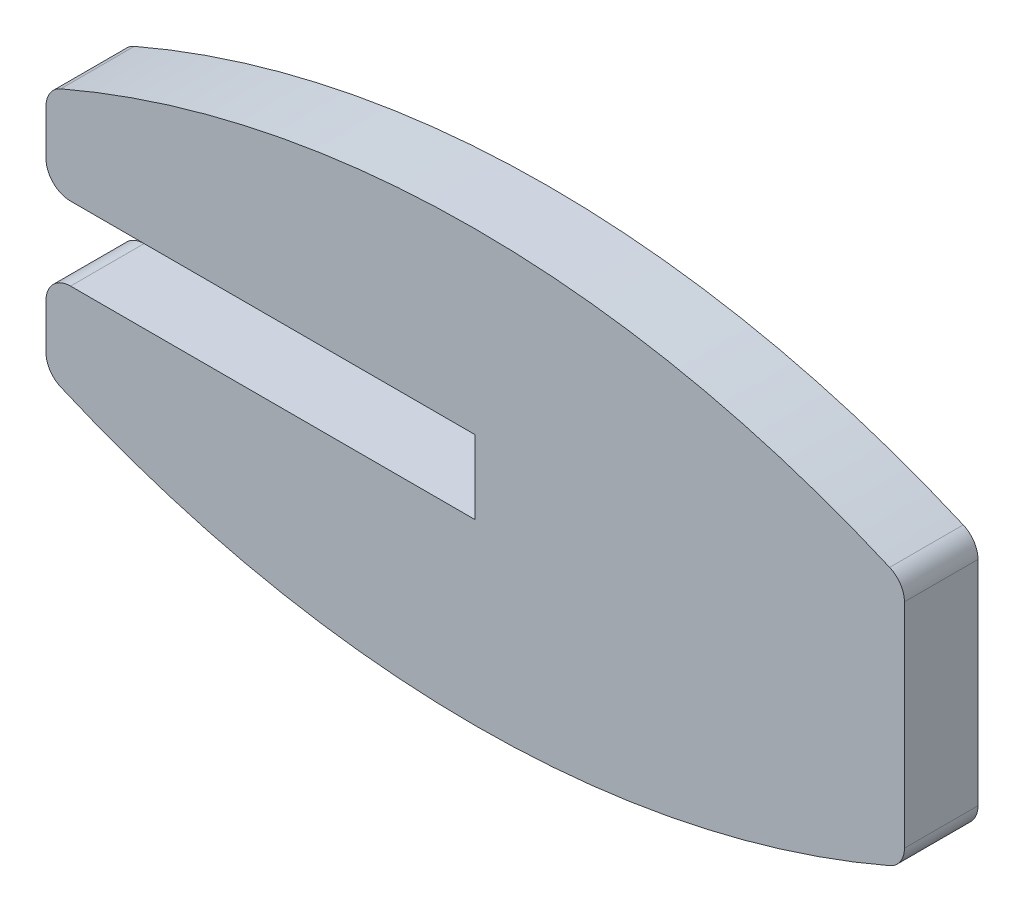
from build123d import *

# Parameters (mm, degrees)
EXTRUDE_1_DEPTH = 3
FILLET_1_R      = 1


with BuildPart() as part:
    # Эскиз1 → Бобышка-Вытянуть1 (new body)
    with BuildSketch(Plane.XY):
        Polygon((-17.5, -1.5), (-17.5, -5), (17.5, -5), (17.5, 5), (-17.5, 5), (-17.5, 1.5), (0, 1.5), (0, -1.5), align=None)
        with BuildLine():
            ThreePointArc((-17.5, 5), (0, 8.770166538), (17.5, 5))
            Line((17.5, 5), (-17.5, 5))
        make_face()
        with BuildLine():
            Line((-17.5, -5), (17.5, -5))
            ThreePointArc((17.5, -5), (0, -8.770166538), (-17.5, -5))
        make_face()
    extrude(amount=EXTRUDE_1_DEPTH)

    # Скругление1
    fillet_1_edges = [part.edges().sort_by_distance(p)[0] for p in [
        (-17.5, 1.5, 1.5),
        (-17.5, 5, 1.5),
        (17.5, 5, 1.5),
        (17.5, -5, 1.5),
        (-17.5, -5, 1.5),
        (-17.5, -1.5, 1.5),
    ]]
    fillet(fillet_1_edges, radius=FILLET_1_R)


solid = part.part
